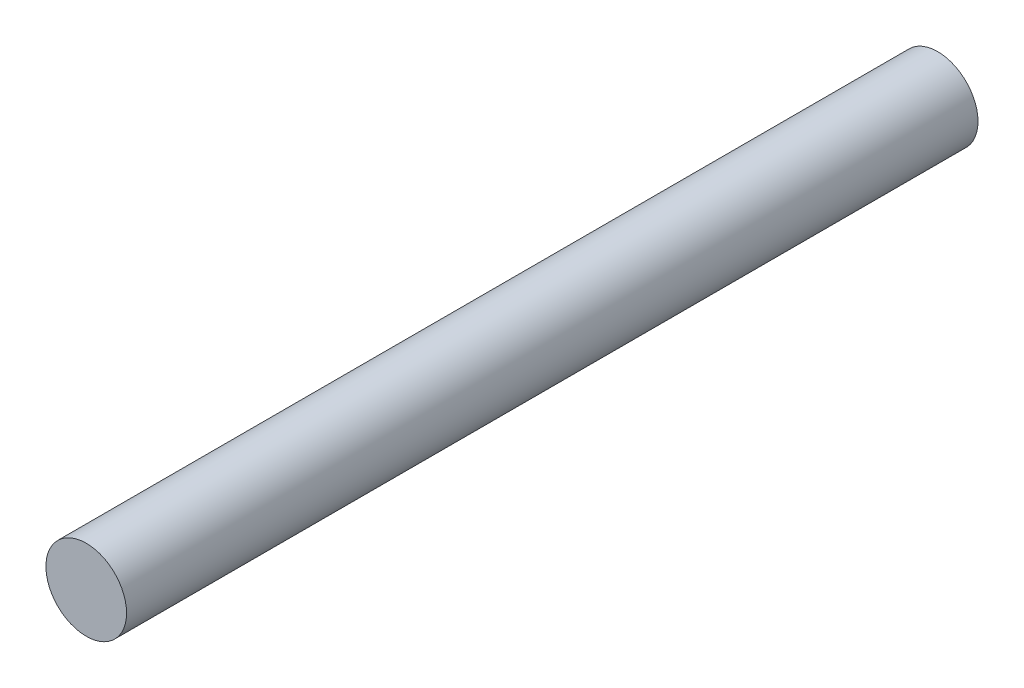
from build123d import *

# Parameters (mm, degrees)
SKETCH1_R           = 1.5875
BOSS_EXTRUDE1_DEPTH = 33.528


with BuildPart() as part:
    # Sketch1 → Boss-Extrude1 (new body)
    with BuildSketch(Plane.XY):
        Circle(SKETCH1_R)
    extrude(amount=BOSS_EXTRUDE1_DEPTH)


solid = part.part
